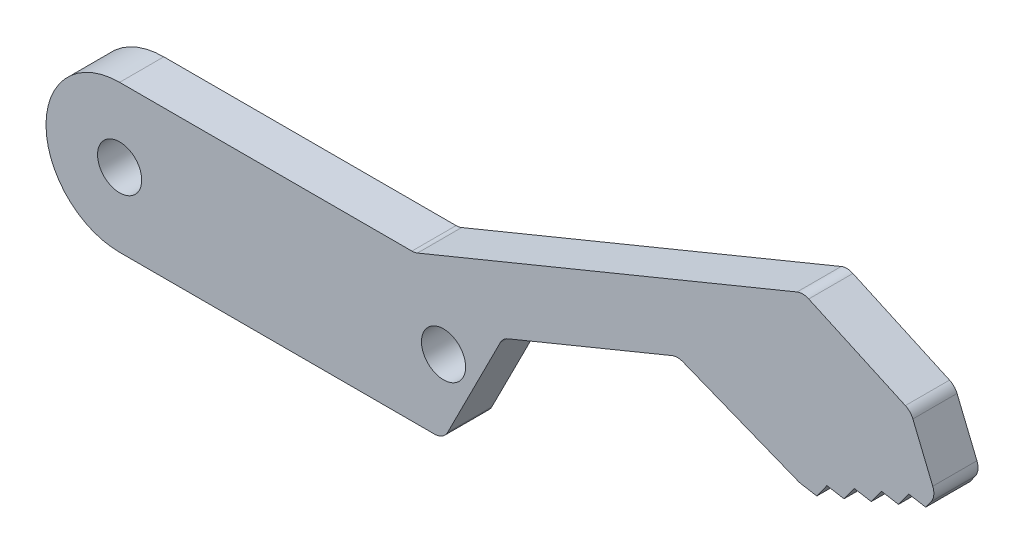
from build123d import *

# Parameters (mm, degrees)
SKETCH_1_R      = 1.5
EXTRUDE_2_DEPTH = 3
FILLET_1_R      = 1
SCALE_1_SCALE   = 2.2


with BuildPart() as part:
    # Эскиз1 → Бобышка-Вытянуть2 (new body)
    with BuildSketch(Plane.XY):
        with BuildLine():
            Line((20.05, 5), (0, 5))
            ThreePointArc((0, 5), (-5, 0), (0, -5))
            Line((0, -5), (22, -5))
            Line((22, -5), (26.028944646, 2.961014192))
            Line((26.028944646, 2.961014192), (37.885430155, 7.835804738))
            Line((37.885430155, 7.835804738), (46.188488025, 4.540007042))
            Line((46.188488025, 4.540007042), (47.351030887, 4.342221563))
            Line((47.351030887, 4.342221563), (48.038244482, 5.300533868))
            Line((48.038244482, 5.300533868), (49.200787343, 5.102748388))
            Line((49.200787343, 5.102748388), (49.888000938, 6.061060693))
            Line((49.888000938, 6.061060693), (51.050543799, 5.863275214))
            Line((51.050543799, 5.863275214), (51.737757394, 6.821587519))
            Line((51.737757394, 6.821587519), (52.900300256, 6.623802039))
            Line((52.900300256, 6.623802039), (53.587513851, 7.582114344))
            Line((53.587513851, 7.582114344), (54.750056712, 7.384328864))
            Line((54.750056712, 7.384328864), (55.437270307, 8.34264117))
            Line((55.437270307, 8.34264117), (53.72608495, 12.504593197))
            Line((53.72608495, 12.504593197), (46.409029503, 15.837507263))
            Line((46.409029503, 15.837507263), (20.05, 5))
        make_face()
        Circle(SKETCH_1_R, mode=Mode.SUBTRACT)
        with Locations((22, 0)):
            Circle(SKETCH_1_R, mode=Mode.SUBTRACT)
    extrude(amount=-EXTRUDE_2_DEPTH)

    # Скругление1
    fillet_1_edges = [part.edges().sort_by_distance(p)[0] for p in [
        (46.188488025, 4.540007042, -1.5),
        (37.885430155, 7.835804738, -1.5),
        (26.028944646, 2.961014192, -1.5),
        (22, -5, -1.5),
        (20.05, 5, -1.5),
        (46.409029503, 15.837507263, -1.5),
        (53.72608495, 12.504593197, -1.5),
        (55.437270307, 8.34264117, -1.5),
    ]]
    fillet(fillet_1_edges, radius=FILLET_1_R)


with BuildPart() as part_1:
    # Масштаб1: scaled about (23.340461949, 3.94478372, -1.5)
    add(part.part.scale(SCALE_1_SCALE).moved(Location((-28.008554339, -4.733740464, 1.8))))


solid = part_1.part
